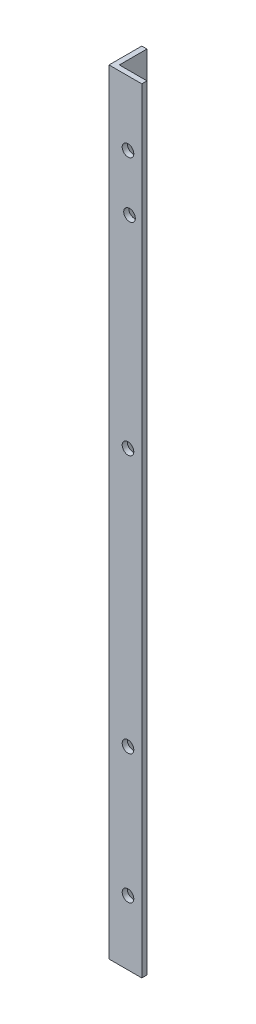
from build123d import *

# Parameters (mm, degrees)
BOSS_EXTRUDE1_DEPTH = 300
SKETCH3_R           = 2.25
CUT_EXTRUDE1_DEPTH  = 300
SKETCH6_R           = 2.25
CUT_EXTRUDE2_DEPTH  = 10
SKETCH8_R           = 2.25
CUT_EXTRUDE3_DEPTH  = 10


with BuildPart() as part:
    # Sketch1 → Boss-Extrude1 (new body)
    with BuildSketch(Plane(origin=(0, 0, 0), x_dir=(1, 0, 0), z_dir=(0, 1, 0))):
        Polygon((0, 0), (12.7, 0), (12.7, 2), (2, 2), (2, 12.7), (0, 12.7), align=None)
    extrude(amount=BOSS_EXTRUDE1_DEPTH)

    # Sketch3 → Cut-Extrude1 (cut)
    with BuildSketch(Plane(origin=(0, 0, -2), x_dir=(-1, 0, 0), z_dir=(0, 0, -1))):
        with Locations((-7.35, 275)):
            Circle(SKETCH3_R)
        with Locations((-7.35, 175)):
            Circle(SKETCH3_R)
        with Locations((-7.35, 75)):
            Circle(SKETCH3_R)
    extrude(amount=-CUT_EXTRUDE1_DEPTH, mode=Mode.SUBTRACT)

    # Sketch6 → Cut-Extrude2 (cut)
    with BuildSketch(Plane(origin=(2, 0, 0), x_dir=(0, 0, -1), z_dir=(1, 0, 0))):
        with Locations((7.35, 225)):
            Circle(SKETCH6_R)
        with Locations((7.35, 125)):
            Circle(SKETCH6_R)
        with Locations((7.35, 25)):
            Circle(SKETCH6_R)
    extrude(amount=-CUT_EXTRUDE2_DEPTH, mode=Mode.SUBTRACT)

    # Sketch8 → Cut-Extrude3 (cut)
    with BuildSketch(Plane.XY):
        with Locations((7.94, 253.6)):
            Circle(SKETCH8_R)
        with Locations((7.35, 25)):
            Circle(SKETCH8_R)
    extrude(amount=-CUT_EXTRUDE3_DEPTH, mode=Mode.SUBTRACT)


solid = part.part
